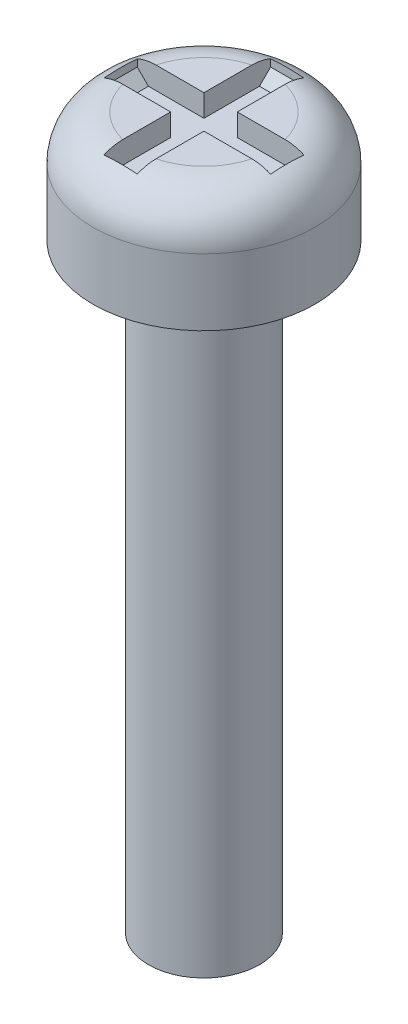
from build123d import *

# Parameters (mm, degrees)
SKETCH1_R           = 2
BOSS_EXTRUDE1_DEPTH = 2
FILLET1_R           = 0.8
SKETCH2_W           = 0.6
SKETCH2_H           = 0.6
CUT_EXTRUDE1_DEPTH  = 0.4
CHAMFER1_SIZE       = 0.2
SKETCH3_R           = 1
BOSS_EXTRUDE2_DEPTH = 10.8


with BuildPart() as part:
    # Sketch1 → Boss-Extrude1 (new body)
    with BuildSketch(Plane(origin=(0, 0, 0), x_dir=(1, 0, 0), z_dir=(0, 1, 0))):
        with Locations(Location((0, 0, 0), (0, 0, 270))):
            Circle(SKETCH1_R)
    extrude(amount=BOSS_EXTRUDE1_DEPTH)

    # Fillet1
    fillet1_edges = [part.edges().sort_by_distance(p)[0] for p in [
        (0, 2, -2),
    ]]
    fillet(fillet1_edges, radius=FILLET1_R)

    # Sketch2 → Cut-Extrude1 (cut)
    with BuildSketch(Plane(origin=(0, 2, 0), x_dir=(1, 0, 0), z_dir=(0, 1, 0))):
        with BuildLine():
            Line((-0.3, 0.3), (-1.161895004, 0.3))
            ThreePointArc((-1.161895004, 0.3), (-1.2, 0), (-1.161895004, -0.3))
            Line((-1.161895004, -0.3), (-0.3, -0.3))
            Line((-0.3, -0.3), (-0.3, 0.3))
        make_face()
        with BuildLine():
            Line((-0.3, 1.161895004), (-0.3, 0.3))
            Line((-0.3, 0.3), (0.3, 0.3))
            Line((0.3, 0.3), (0.3, 1.161895004))
            ThreePointArc((0.3, 1.161895004), (0, 1.2), (-0.3, 1.161895004))
        make_face()
        with BuildLine():
            Line((-1.161895004, 0.3), (-1.5, 0.3))
            Line((-1.5, 0.3), (-1.5, -0.3))
            Line((-1.5, -0.3), (-1.161895004, -0.3))
            ThreePointArc((-1.161895004, -0.3), (-1.2, 0), (-1.161895004, 0.3))
        make_face()
        with BuildLine():
            Line((-0.3, 1.5), (-0.3, 1.161895004))
            ThreePointArc((-0.3, 1.161895004), (0, 1.2), (0.3, 1.161895004))
            Line((0.3, 1.161895004), (0.3, 1.5))
            Line((0.3, 1.5), (-0.3, 1.5))
        make_face()
        with BuildLine():
            Line((1.161895004, 0.3), (0.3, 0.3))
            Line((0.3, 0.3), (0.3, -0.3))
            Line((0.3, -0.3), (1.161895004, -0.3))
            ThreePointArc((1.161895004, -0.3), (1.190435636, -0.151205151), (1.2, 0))
            ThreePointArc((1.2, 0), (1.190435636, 0.151205151), (1.161895004, 0.3))
        make_face()
        with BuildLine():
            Line((1.5, 0.3), (1.161895004, 0.3))
            ThreePointArc((1.161895004, 0.3), (1.190435636, 0.151205151), (1.2, 0))
            ThreePointArc((1.2, 0), (1.190435636, -0.151205151), (1.161895004, -0.3))
            Line((1.161895004, -0.3), (1.5, -0.3))
            Line((1.5, -0.3), (1.5, 0.3))
        make_face()
        Rectangle(SKETCH2_W, SKETCH2_H)
        with BuildLine():
            Line((0.3, -0.3), (-0.3, -0.3))
            Line((-0.3, -0.3), (-0.3, -1.161895004))
            ThreePointArc((-0.3, -1.161895004), (0, -1.2), (0.3, -1.161895004))
            Line((0.3, -1.161895004), (0.3, -0.3))
        make_face()
        with BuildLine():
            ThreePointArc((0.3, -1.161895004), (0, -1.2), (-0.3, -1.161895004))
            Line((-0.3, -1.161895004), (-0.3, -1.5))
            Line((-0.3, -1.5), (0.3, -1.5))
            Line((0.3, -1.5), (0.3, -1.161895004))
        make_face()
    extrude(amount=-CUT_EXTRUDE1_DEPTH, mode=Mode.SUBTRACT)

    # Chamfer1
    chamfer1_edges = [part.edges().sort_by_distance(p)[0] for p in [
        (-1.5, 1.6, 0),
        (0, 1.6, 1.5),
        (0, 1.6, -1.5),
        (1.5, 1.6, 0),
    ]]
    chamfer(chamfer1_edges, length=CHAMFER1_SIZE)

    # Sketch3 → Boss-Extrude2 (add)
    with BuildSketch(Plane.XZ):
        with Locations(Location((0, 0, 0), (0, 0, 90))):
            Circle(SKETCH3_R)
    extrude(amount=BOSS_EXTRUDE2_DEPTH)


solid = part.part
